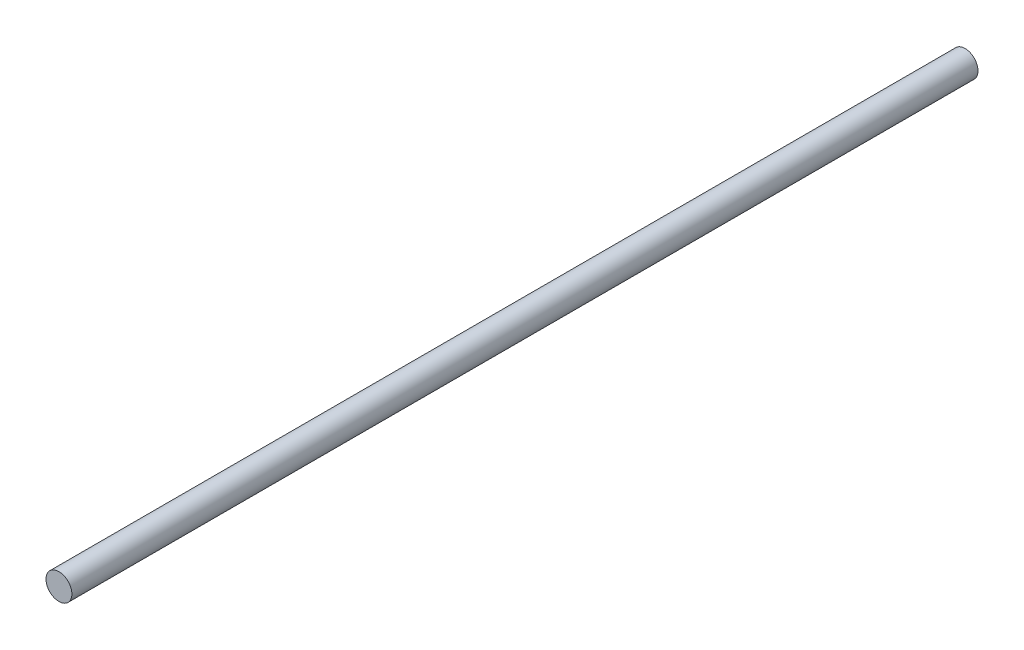
from build123d import *

# Parameters (mm, degrees)
BOSS_EXTRUDE1_DEPTH      = 140
BOSS_EXTRUDE1_DEPTH_BACK = 140
SKETCH1_R                = 4


with BuildPart() as part:
    # Sketch1 → Boss-Extrude1 (new, two sides: drawn at the far end of the back side and taken through both)
    with BuildSketch(Plane.XY.offset(-BOSS_EXTRUDE1_DEPTH_BACK)):
        Circle(SKETCH1_R)
    extrude(amount=BOSS_EXTRUDE1_DEPTH + BOSS_EXTRUDE1_DEPTH_BACK)


solid = part.part
